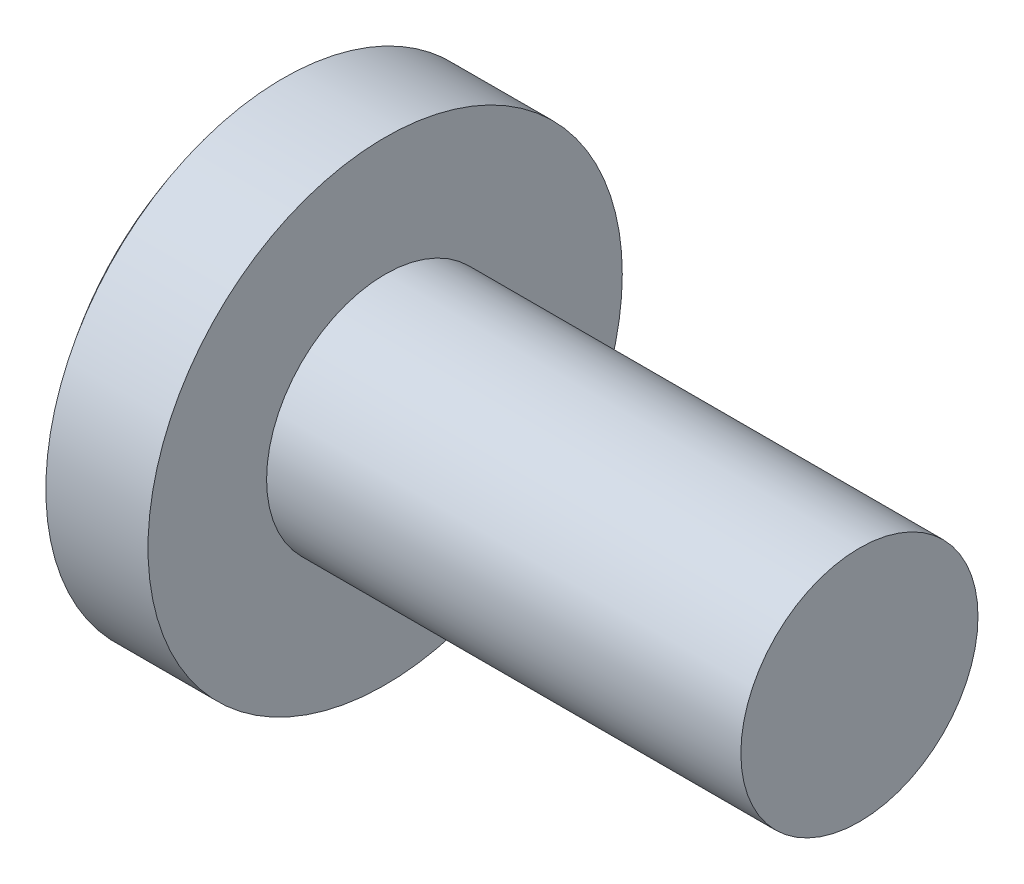
from build123d import *

# Parameters (mm, degrees)
CROSSRECESS_DEPTH = 2.17
FILLET5_R         = 0.3
DRAFT1_ANGLE      = -30


with BuildPart() as part:
    # Sketch1 → Base (revolve)
    with BuildSketch(Plane.XY, mode=Mode.PRIVATE) as base_sk:
        with BuildLine():
            Line((11.1, 2), (4.5, 2))
            Line((4.5, 2), (3.1, 2))
            Line((3.1, 2), (3.1, 2.35))
            Line((3.1, 2.35), (3.1, 4))
            Line((3.1, 4), (1.376524617, 4))
            ThreePointArc((1.376524617, 4), (0.353757652, 2.115113473), (0, 0))
            Line((0, 0), (11.1, 0))
            Line((11.1, 0), (11.1, 2))
        make_face()
    revolve(base_sk.sketch.rotate(Axis((4.515812911, 0, 0), (-1, 0, 0)), 90), axis=Axis((4.515812911, 0, 0), (-1, 0, 0)))

    # Sketch6 → CrossRecess (cut)
    with BuildSketch(Plane(origin=(0, 0, 0), x_dir=(0, 0, -1), z_dir=(1, 0, 0))):
        Polygon((0.44, 0.44), (0.44, 2.2), (-0.44, 2.2), (-0.44, 0.44), (-2.2, 0.44), (-2.2, -0.44), (-0.44, -0.44), (-0.44, -2.2), (0.44, -2.2), (0.44, -0.44), (2.2, -0.44), (2.2, 0.44), align=None)
    extrude(amount=CROSSRECESS_DEPTH, mode=Mode.SUBTRACT)

    # Fillet5
    fillet5_edges = [part.edges().sort_by_distance(p)[0] for p in [
        (1.099926585, 0.44, 0.44),
        (1.099926585, -0.44, 0.44),
        (1.099926585, -0.44, -0.44),
        (1.099926585, 0.44, -0.44),
    ]]
    fillet(fillet5_edges, radius=FILLET5_R)

    # Draft1
    draft1_faces = [part.faces().sort_by_distance(p)[0] for p in [
        (1.27944778, -2.2, 0),
        (1.27944778, 0, -2.2),
        (1.27944778, 0, 2.2),
        (1.27944778, 2.2, 0),
    ]]
    draft(draft1_faces, Plane(origin=(0, 0, 0), x_dir=(0, 0, 1), z_dir=(1, 0, 0)), DRAFT1_ANGLE)


solid = part.part
